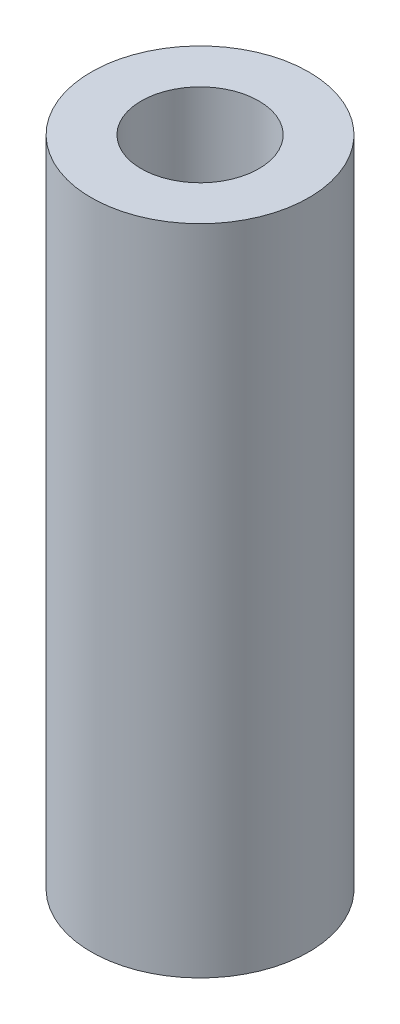
from build123d import *

# Parameters (mm, degrees)
SKETCH1_R           = 6.35
SKETCH1_R_2         = 3.429
BOSS_EXTRUDE1_DEPTH = 38.1


with BuildPart() as part:
    # Sketch1 → Boss-Extrude1 (new body)
    with BuildSketch(Plane(origin=(0, 0, 0), x_dir=(1, 0, 0), z_dir=(0, 1, 0))):
        with Locations(Location((0, 0, 0), (0, 0, 90))):
            Circle(SKETCH1_R)
        with Locations(Location((0, 0, 0), (0, 0, 90))):
            Circle(SKETCH1_R_2, mode=Mode.SUBTRACT)
    extrude(amount=BOSS_EXTRUDE1_DEPTH)


solid = part.part
